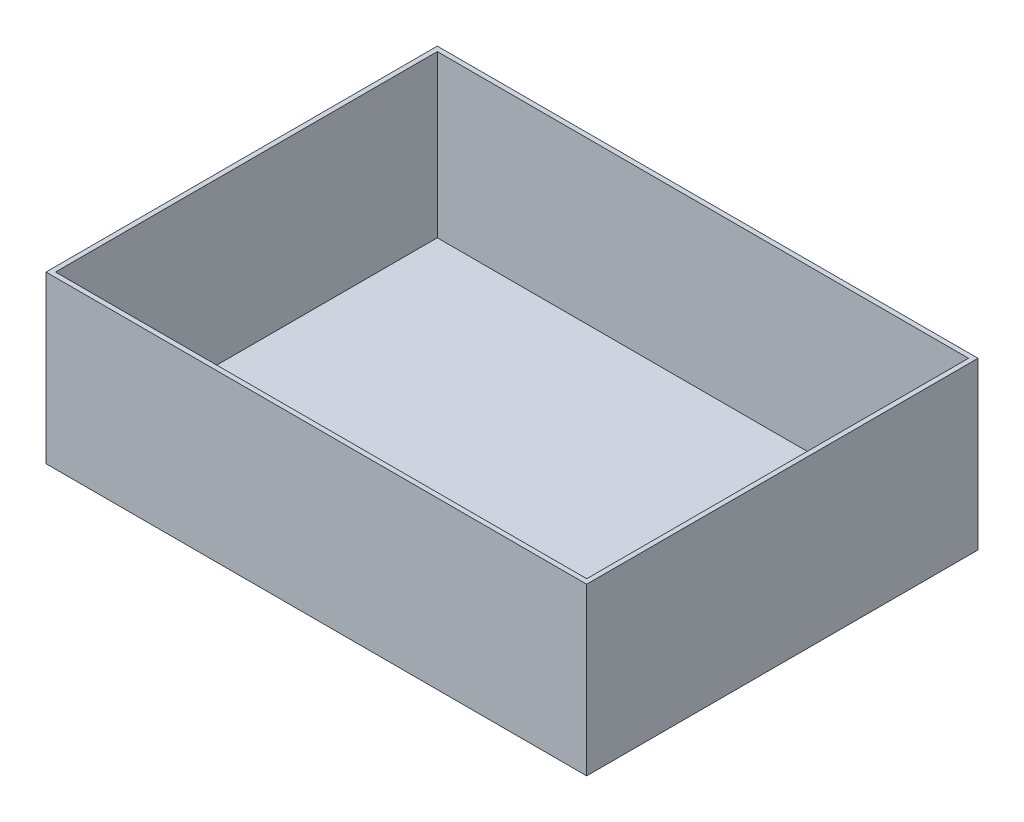
from build123d import *

# Parameters (mm, degrees)
SKETCH1_W           = 228
SKETCH1_H           = 165
BOSS_EXTRUDE1_DEPTH = 70
SKETCH2_OUTSIDE_W   = 288.004
SKETCH2_OUTSIDE_H   = 225.004
SKETCH2_OUTSIDE_W_2 = 228
SKETCH2_OUTSIDE_H_2 = 165
SKETCH2_OUTSIDE_W_3 = 224
SKETCH2_OUTSIDE_H_3 = 161
CUT_EXTRUDE1_DEPTH  = 68


with BuildPart() as part:
    # Sketch1 → Boss-Extrude1 (new body)
    with BuildSketch(Plane(origin=(0, 0, 0), x_dir=(1, 0, 0), z_dir=(0, 1, 0))):
        with Locations((17.256257449, -4.235399285)):
            Rectangle(SKETCH1_W, SKETCH1_H)
    extrude(amount=BOSS_EXTRUDE1_DEPTH)

    # Sketch2 outside → Cut-Extrude1 (cut)
    # profile 1 of 2: a face of its own
    with BuildSketch(Plane(origin=(0, 70, 0), x_dir=(1, 0, 0), z_dir=(0, 1, 0))):
        with Locations((17.256, -4.235)):
            Rectangle(SKETCH2_OUTSIDE_W, SKETCH2_OUTSIDE_H)
        with Locations((17.256257449, -4.235399285)):
            Rectangle(SKETCH2_OUTSIDE_W_2, SKETCH2_OUTSIDE_H_2, mode=Mode.SUBTRACT)
    # profile 2 of 2: a face of its own
    with BuildSketch(Plane(origin=(0, 70, 0), x_dir=(1, 0, 0), z_dir=(0, 1, 0))):
        with Locations((17.256257449, -4.235399285)):
            Rectangle(SKETCH2_OUTSIDE_W_3, SKETCH2_OUTSIDE_H_3)
    extrude(amount=-CUT_EXTRUDE1_DEPTH, mode=Mode.SUBTRACT)


solid = part.part
